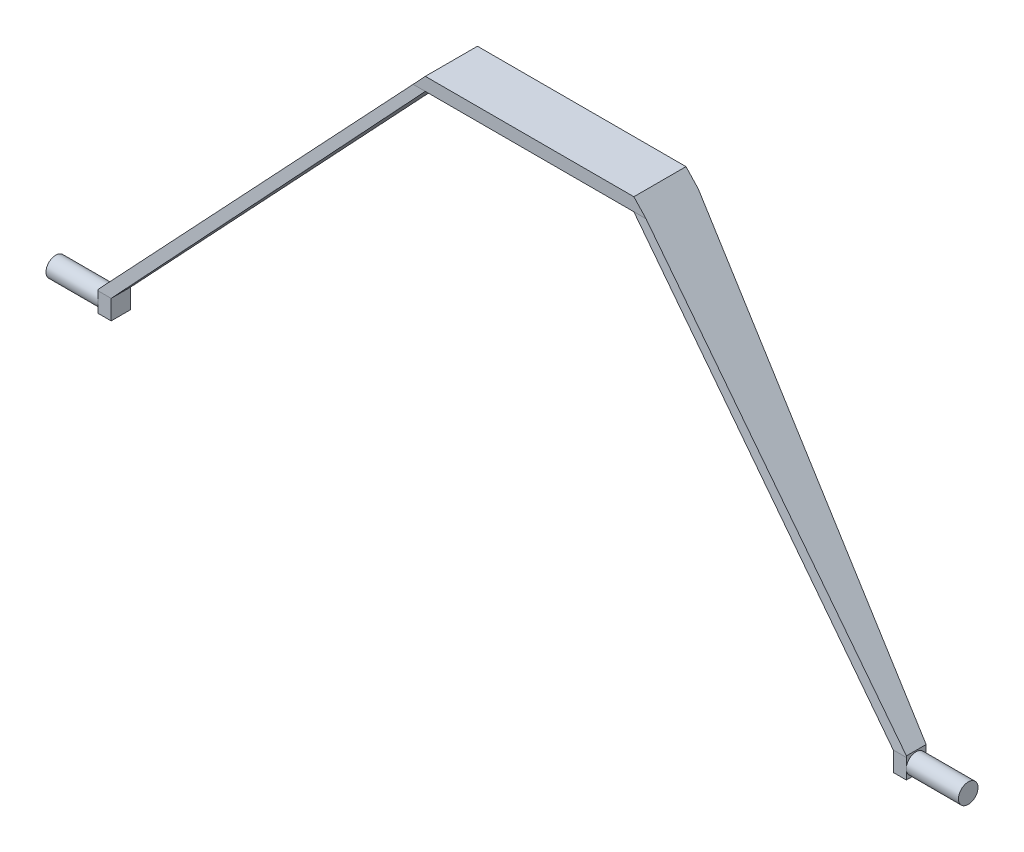
from build123d import *

# Parameters (mm, degrees)
BOSS_EXTRUDE6_DEPTH            = 53.34
BOSS_EXTRUDE6_DEPTH_BACK       = 101.6
SKETCH13_R                     = 19.05
BOSS_EXTRUDE7_DEPTH            = 101.6
CUT_EXTRUDE8_REACH             = 992.358
CUT_EXTRUDE8_DIRECTION_2_REACH = 992.358


with BuildPart() as part:
    # Sketch12 → Boss-Extrude6 (new, two sides: drawn at the far end of the back side and taken through both)
    with BuildSketch(Plane.XY.offset(-BOSS_EXTRUDE6_DEPTH_BACK)):
        Polygon((-203.2, 241.3), (203.2, 241.3), (787.471663752, -383.669201703), (787.471663752, -424.309201703), (762.071663752, -424.309201703), (762.071663752, -386.209201703), (203.2, 215.9), (-203.2, 215.9), (-762.071663752, -386.209201703), (-762.071663752, -424.309201703), (-787.471663752, -424.309201703), (-787.471663752, -383.669201703), align=None)
    extrude(amount=BOSS_EXTRUDE6_DEPTH + BOSS_EXTRUDE6_DEPTH_BACK)

    # Sketch13 → Boss-Extrude7 (add)
    with BuildSketch(Plane(origin=(787.471663752, 0, 0), x_dir=(0, 0, -1), z_dir=(1, 0, 0))):
        with Locations(Location((-34.29, -405.259201703, 0), (0, 0, 180))):
            Circle(SKETCH13_R)
    boss_extrude7 = extrude(amount=BOSS_EXTRUDE7_DEPTH)

    # Mirror1: Boss-Extrude7 across plane
    add(boss_extrude7.mirror(Plane(origin=(0, 0, 0), x_dir=(0, 0, 1), z_dir=(1, 0, 0))))

    # Cut-Extrude8: up to this plane
    cut_extrude8_end = Plane(origin=(-203.2, 241.3, -101.6), z_dir=(-0.7304911811601322, 0.6829221289775833, 0))
    # Sketch14 → Cut-Extrude8 (cut, up to the surface)
    with BuildSketch(Plane(origin=(0, 0, 0), x_dir=(0, 0, -1), z_dir=(1, 0, 0)), mode=Mode.PRIVATE) as cut_extrude8_sk1:
        Polygon((0, 241.3), (0, 215.9), (-53.34, -386.209201703), (-53.34, 241.3), align=None)
    cut_extrude8_tool1 = split(extrude(cut_extrude8_sk1.sketch, amount=-CUT_EXTRUDE8_REACH, mode=Mode.PRIVATE), bisect_by=cut_extrude8_end, keep=Keep.BOTH, mode=Mode.PRIVATE)
    add(cut_extrude8_tool1.solids().sort_by_distance((0, 31.800889, 34.868308))[0], mode=Mode.SUBTRACT)
    # Sketch14 → Cut-Extrude8 (cut, up to the surface)
    with BuildSketch(Plane(origin=(0, 0, 0), x_dir=(0, 0, -1), z_dir=(1, 0, 0)), mode=Mode.PRIVATE) as cut_extrude8_sk2:
        Polygon((101.6, 215.9), (-15.24, -386.209201703), (-15.24, -424.309201703), (101.6, -424.309201703), align=None)
    cut_extrude8_tool2 = split(extrude(cut_extrude8_sk2.sketch, amount=-CUT_EXTRUDE8_REACH, mode=Mode.PRIVATE), bisect_by=cut_extrude8_end, keep=Keep.BOTH, mode=Mode.PRIVATE)
    add(cut_extrude8_tool2.solids().sort_by_distance((0, -210.192787, -60.465735))[0], mode=Mode.SUBTRACT)

    # Cut-Extrude8 direction 2: up to this plane
    cut_extrude8_direction_2_end = Plane(origin=(203.2, 241.3, -101.6), z_dir=(0.7304911811601321, 0.6829221289775835, 0))
    # Sketch14 → Cut-Extrude8 direction 2 (cut, up to the surface)
    with BuildSketch(Plane(origin=(0, 0, 0), x_dir=(0, 0, -1), z_dir=(1, 0, 0)), mode=Mode.PRIVATE) as cut_extrude8_direction_2_sk1:
        Polygon((0, 241.3), (0, 215.9), (-53.34, -386.209201703), (-53.34, 241.3), align=None)
    cut_extrude8_direction_2_tool1 = split(extrude(cut_extrude8_direction_2_sk1.sketch, amount=CUT_EXTRUDE8_DIRECTION_2_REACH, mode=Mode.PRIVATE), bisect_by=cut_extrude8_direction_2_end, keep=Keep.BOTH, mode=Mode.PRIVATE)
    add(cut_extrude8_direction_2_tool1.solids().sort_by_distance((0, 31.800889, 34.868308))[0], mode=Mode.SUBTRACT)
    # Sketch14 → Cut-Extrude8 direction 2 (cut, up to the surface)
    with BuildSketch(Plane(origin=(0, 0, 0), x_dir=(0, 0, -1), z_dir=(1, 0, 0)), mode=Mode.PRIVATE) as cut_extrude8_direction_2_sk2:
        Polygon((101.6, 215.9), (-15.24, -386.209201703), (-15.24, -424.309201703), (101.6, -424.309201703), align=None)
    cut_extrude8_direction_2_tool2 = split(extrude(cut_extrude8_direction_2_sk2.sketch, amount=CUT_EXTRUDE8_DIRECTION_2_REACH, mode=Mode.PRIVATE), bisect_by=cut_extrude8_direction_2_end, keep=Keep.BOTH, mode=Mode.PRIVATE)
    add(cut_extrude8_direction_2_tool2.solids().sort_by_distance((0, -210.192787, -60.465735))[0], mode=Mode.SUBTRACT)


solid = part.part
